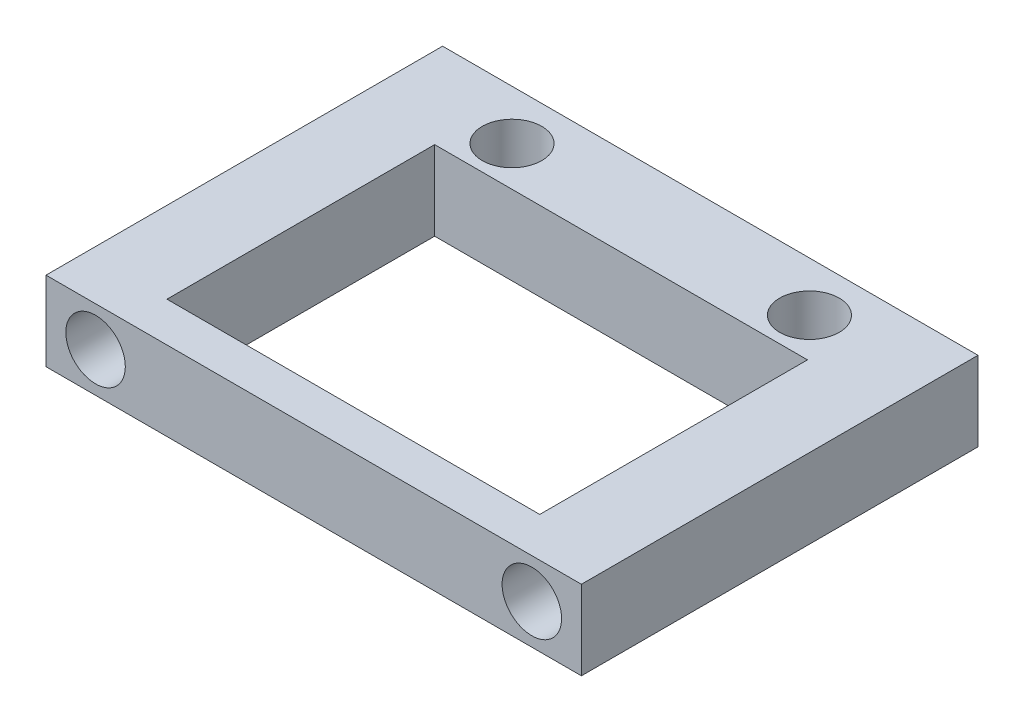
from build123d import *

# Parameters (mm, degrees)
SKETCH1_W           = 27
SKETCH1_H           = 20
SKETCH1_R           = 1.5
SKETCH1_W_2         = 18.8
SKETCH1_H_2         = 13.5
BOSS_EXTRUDE1_DEPTH = 4
SKETCH2_R           = 1.5
CUT_EXTRUDE2_DEPTH  = 6
CUT_EXTRUDE3_START  = -6
SKETCH5_R           = 1.5
CUT_EXTRUDE3_DEPTH  = 6


with BuildPart() as part:
    # Sketch1 → Boss-Extrude1 (new body)
    with BuildSketch(Plane(origin=(0, 0, 0), x_dir=(1, 0, 0), z_dir=(0, 1, 0))):
        with Locations((0, 1.25)):
            Rectangle(SKETCH1_W, SKETCH1_H)
        with Locations(Location((-7.5, 8.75, 0), (0, 0, 270))):
            Circle(SKETCH1_R, mode=Mode.SUBTRACT)
        with Locations(Location((7.5, 8.75, 0), (0, 0, 90))):
            Circle(SKETCH1_R, mode=Mode.SUBTRACT)
        Rectangle(SKETCH1_W_2, SKETCH1_H_2, mode=Mode.SUBTRACT)
    extrude(amount=BOSS_EXTRUDE1_DEPTH)

    # Sketch2 → Cut-Extrude2 (cut)
    with BuildSketch(Plane(origin=(0, 0, -11.25), x_dir=(-1, 0, 0), z_dir=(0, 0, -1))):
        with Locations((11, 2)):
            Circle(SKETCH2_R)
        with Locations((-11, 2)):
            Circle(SKETCH2_R)
    extrude(amount=-CUT_EXTRUDE2_DEPTH, mode=Mode.SUBTRACT)

    # Sketch5 → Cut-Extrude3 (cut)
    with BuildSketch(Plane.XY.offset(8.75).offset(CUT_EXTRUDE3_START)):
        with Locations(Location((11, 2, 0), (0, 0, 180))):
            Circle(SKETCH5_R)
        with Locations(Location((-11, 2, 0), (0, 0, 180))):
            Circle(SKETCH5_R)
    extrude(amount=CUT_EXTRUDE3_DEPTH, mode=Mode.SUBTRACT)


solid = part.part
